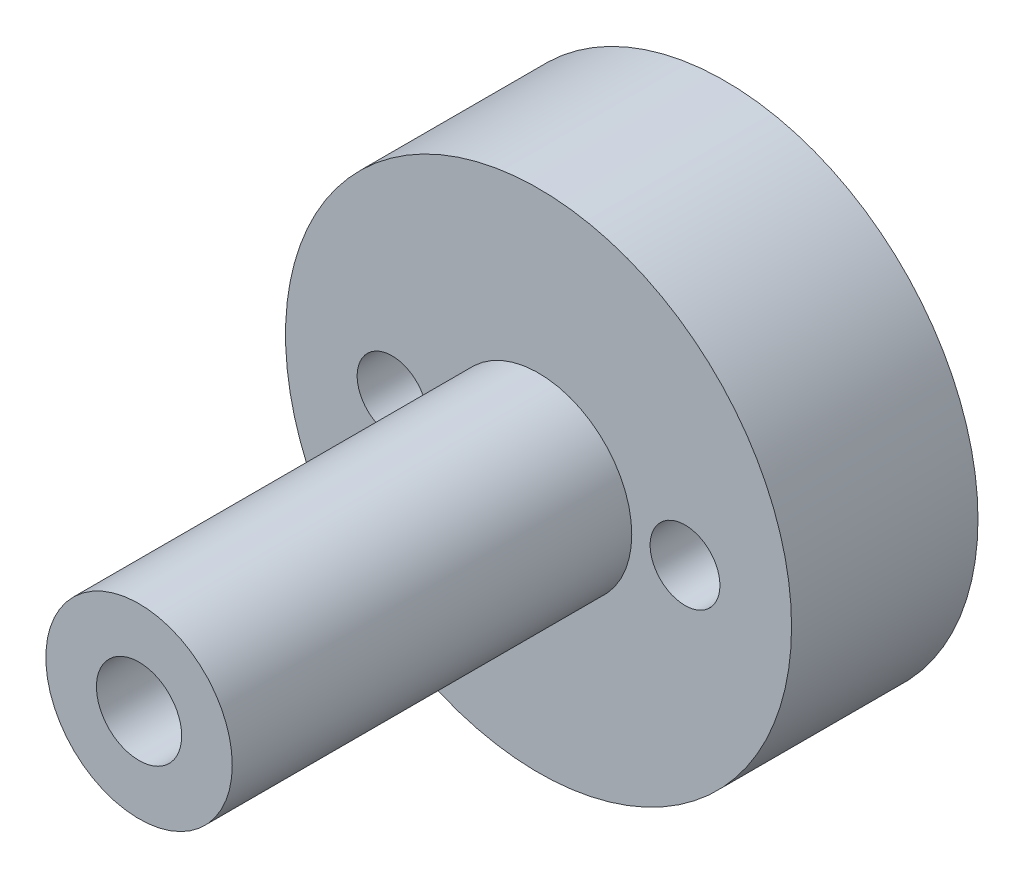
from build123d import *

# Parameters (mm, degrees)
SKETCH1_R               = 9.5
SKETCH1_R_2             = 7.6
BOSS_EXTRUDE1_DEPTH     = 5
SKETCH2_R               = 9.5
SKETCH2_R_2             = 1.31
BOSS_EXTRUDE2_DEPTH     = 2
SKETCH3_R               = 3.5
SKETCH3_R_2             = 1.6
BOSS_EXTRUDE3_DEPTH     = 15
CUT_EXTRUDE1_DEPTH      = 21.137030566
CUT_EXTRUDE1_DEPTH_BACK = 21.137030566
SKETCH3_3_R             = 1.31


with BuildPart() as part:
    # Sketch1 → Boss-Extrude1 (new body)
    with BuildSketch(Plane.XY):
        Circle(SKETCH1_R)
        Circle(SKETCH1_R_2, mode=Mode.SUBTRACT)
    extrude(amount=BOSS_EXTRUDE1_DEPTH)

    # Sketch2 → Boss-Extrude2 (add)
    with BuildSketch(Plane.XY.offset(5)):
        Circle(SKETCH2_R)
        Circle(SKETCH2_R_2, mode=Mode.SUBTRACT)
    extrude(amount=BOSS_EXTRUDE2_DEPTH)

    # Sketch3 → Boss-Extrude3 (add)
    with BuildSketch(Plane.XY.offset(7)):
        Circle(SKETCH3_R)
        Circle(SKETCH3_R_2, mode=Mode.SUBTRACT)
    extrude(amount=BOSS_EXTRUDE3_DEPTH)

    # Sketch3<3> → Cut-Extrude1 (cut, two sides: drawn at the far end of the back side and taken through both)
    with BuildSketch(Plane.XY.offset(7).offset(-CUT_EXTRUDE1_DEPTH_BACK)):
        with Locations((-5.5, 0)):
            Circle(SKETCH3_3_R)
        with Locations((5.5, 0)):
            Circle(SKETCH3_3_R)
    extrude(amount=CUT_EXTRUDE1_DEPTH + CUT_EXTRUDE1_DEPTH_BACK, mode=Mode.SUBTRACT)


solid = part.part
